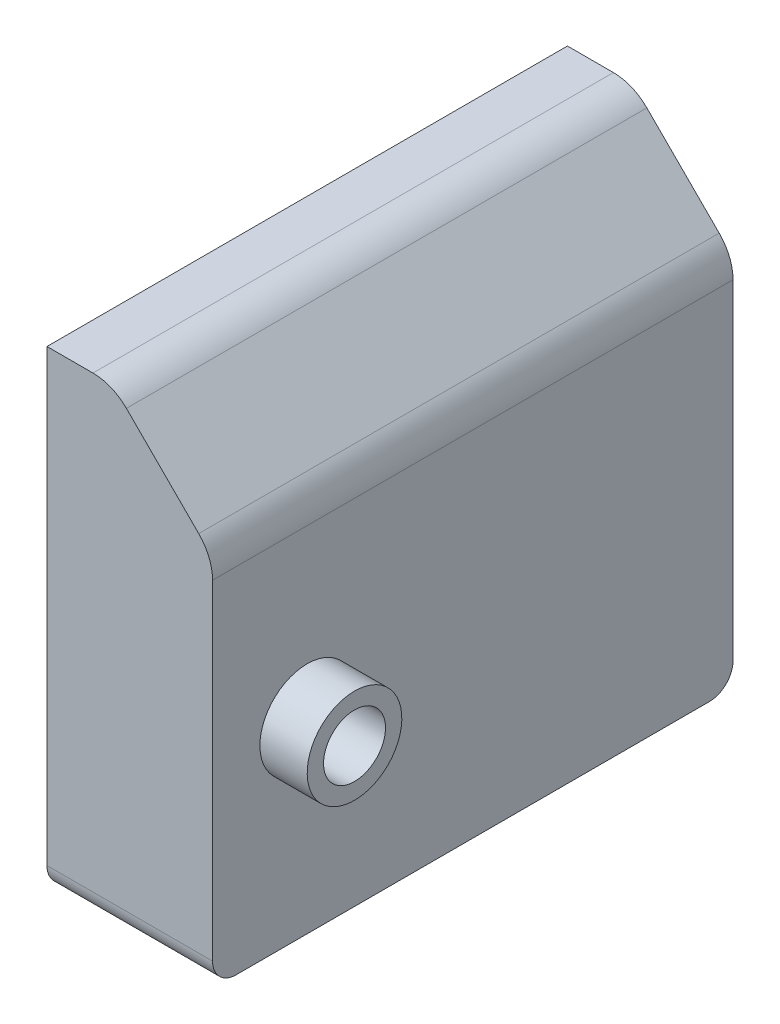
from build123d import *

# Parameters (mm, degrees)
BOSS_EXTRUDE1_DEPTH = 2
BOSS_EXTRUDE2_DEPTH = 2
BOSS_EXTRUDE3_DEPTH = 106
SKETCH4_R           = 10
SKETCH4_R_2         = 6.55
BOSS_EXTRUDE4_DEPTH = 10
FILLET1_R           = 5
FILLET2_R           = 10


with BuildPart() as part:
    # Sketch1 → Boss-Extrude1 (new body)
    with BuildSketch(Plane.XY):
        Polygon((1, -21.742716482), (14.860117326, -21.742716482), (36, -42.882599156), (36, -121.742716482), (1, -121.742716482), align=None)
    extrude(amount=-BOSS_EXTRUDE1_DEPTH)



with BuildPart() as body_2:
    # Sketch2 → Boss-Extrude2 (new body)
    with BuildSketch(Plane(origin=(0, 0, -110), x_dir=(-1, 0, 0), z_dir=(0, 0, -1))):
        Polygon((-1, -121.742716482), (-1, -21.742716482), (-14.860117326, -21.742716482), (-36, -42.882599156), (-36, -121.742716482), align=None)
    extrude(amount=-BOSS_EXTRUDE2_DEPTH)


with BuildPart() as part_1:
    add(part.part)

    add(body_2.part)  # Boss-Extrude3 merges body 2
    # Sketch3 → Boss-Extrude3 (add)
    with BuildSketch(Plane(origin=(0, 0, -2), x_dir=(-1, 0, 0), z_dir=(0, 0, -1))):
        Polygon((-1, -23.742716482), (-14.031690201, -23.742716482), (-34, -43.71102628), (-34, -119.742716482), (-1, -119.742716482), (-1, -121.742716482), (-36, -121.742716482), (-36, -42.882599156), (-14.860117326, -21.742716482), (-1, -21.742716482), align=None)
    extrude(amount=BOSS_EXTRUDE3_DEPTH)

    # Sketch4 → Boss-Extrude4 (add)
    with BuildSketch(Plane(origin=(36, 0, 0), x_dir=(0, 0, -1), z_dir=(1, 0, 0))):
        with Locations(Location((20, -82.312657819, 0), (0, 0, 90))):
            Circle(SKETCH4_R)
        with Locations(Location((20, -82.312657819, 0), (0, 0, 90))):
            Circle(SKETCH4_R_2, mode=Mode.SUBTRACT)
    extrude(amount=BOSS_EXTRUDE4_DEPTH)

    # Fillet1
    fillet1_edges = [part_1.edges().sort_by_distance(p)[0] for p in [
        (17.5, -119.742716482, -2),
        (17.5, -119.742716482, -108),
        (18.5, -121.742716482, -110),
        (18.5, -121.742716482, 0),
    ]]
    fillet(fillet1_edges, radius=FILLET1_R)

    # Fillet2
    fillet2_edges = [part_1.edges().sort_by_distance(p)[0] for p in [
        (34, -43.71102628, -55),
        (14.031690201, -23.742716482, -55),
        (14.860117326, -21.742716482, -55),
        (36, -42.882599156, -55),
    ]]
    fillet(fillet2_edges, radius=FILLET2_R)


solid = part_1.part
